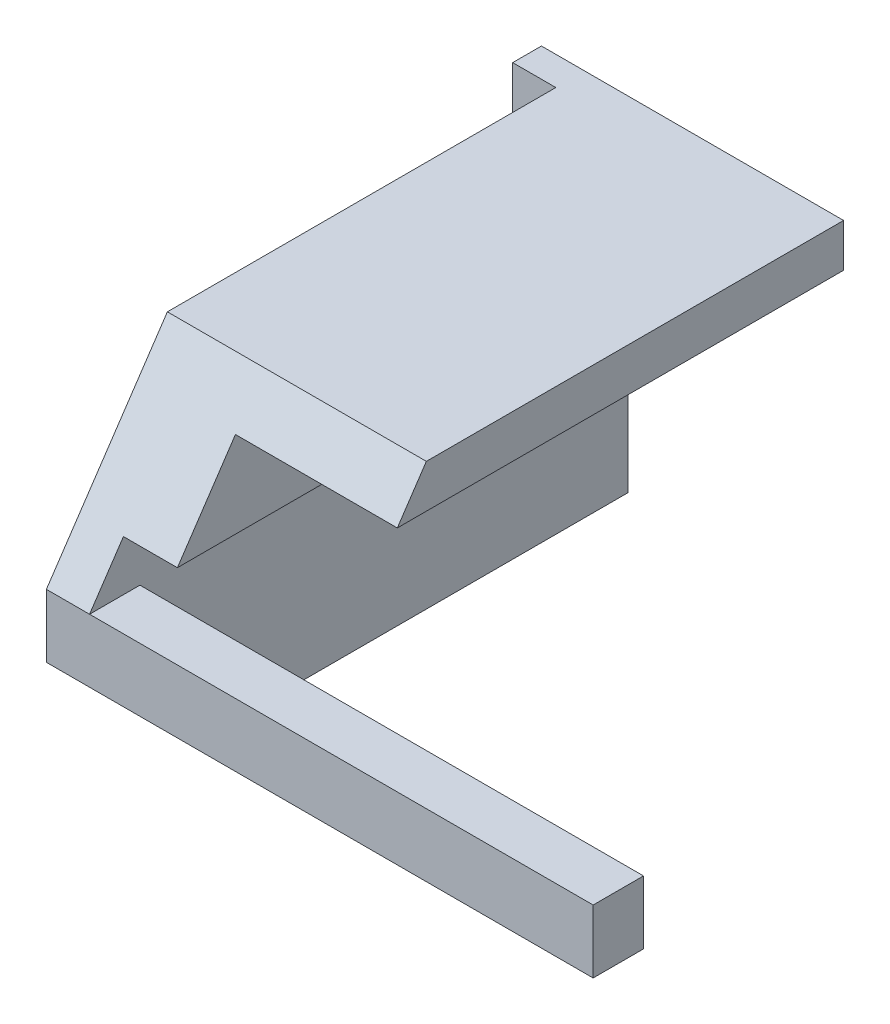
from build123d import *

# Parameters (mm, degrees)
EXTRUDE_1_DEPTH        = 5
EXTRUDE_1_DEPTH_BACK   = 3
SKETCH_2_W             = 29
SKETCH_2_H             = 29
SKETCH_3_W             = 25
SKETCH_3_H             = 25
CUT_EXTRUDE_1_DEPTH    = 3
SKETCH_5_R             = 1
CUT_EXTRUDE_3_DEPTH    = 3
CUT_EXTRUDE_4_DEPTH    = 23.011360703
HOLE_WIZARD_M4_1_D     = 3.3
HOLE_WIZARD_M4_1_DEPTH = 10.1
HOLE_WIZARD_M4_1_TIP   = 0.991420021
SKETCH_4_W             = 8
SKETCH_4_H             = 29
EXTRUDE_2_DEPTH        = 13.4052
SKETCH_7_W             = 29
SKETCH_7_H             = 5
EXTRUDE_3_DEPTH        = 5
SKETCH_10_W            = 29
SKETCH_10_H            = 13.4052
CUT_EXTRUDE_5_DEPTH    = 35.028667136
EXTRUDE_4_DEPTH        = 28
SKETCH_13_W            = 22.441758485
SKETCH_13_H            = 29
CUT_EXTRUDE_7_DEPTH    = 20.8948
SKETCH_14_W            = 27
SKETCH_14_H            = 6.1052
CUT_EXTRUDE_8_DEPTH    = 10
EXTRUDE_5_DEPTH        = 10
SKETCH_16_W            = 12.441758485
SKETCH_16_H            = 20.8948
CUT_EXTRUDE_9_DEPTH    = 5
CUT_EXTRUDE_10_DEPTH   = 5
SKETCH_18_W            = 7.441758485
SKETCH_18_H            = 20.8948
CUT_EXTRUDE_11_DEPTH   = 1.9068532
SKETCH_19_W            = 18
SKETCH_19_H            = 8
CUT_EXTRUDE_12_DEPTH   = 7
SKETCH_20_W            = 3.0931468
SKETCH_20_H            = 11
EXTRUDE_6_DEPTH        = 20
SKETCH_21_W            = 3.0931468
SKETCH_21_H            = 2.8948
CUT_EXTRUDE_13_DEPTH   = 7.441758485
SKETCH_22_W            = 29
SKETCH_22_H            = 7
CUT_EXTRUDE_14_DEPTH   = 7.558241515
EXTRUDE_7_DEPTH        = 3
SKETCH_24_W            = 3
SKETCH_24_H            = 11
CUT_EXTRUDE_15_DEPTH   = 50.942466899
CUT_EXTRUDE_16_DEPTH   = 3.8082415
SKETCH_26_W            = 11.249999985
SKETCH_26_H            = 6.1052
CUT_EXTRUDE_17_DEPTH   = 6.0931468
SKETCH_27_W            = 6.0931468
SKETCH_27_H            = 6.1052
CUT_EXTRUDE_18_DEPTH   = 43.86096708
CUT_EXTRUDE_19_DEPTH   = 3.1052
SKETCH_30_W            = 3.750000015
SKETCH_30_H            = 32.721043552
CUT_EXTRUDE_20_DEPTH   = 7.8948
CUT_EXTRUDE_21_DEPTH   = 4.9068532
SKETCH_32_W            = 31.249999985
SKETCH_32_H            = 6.0931468
CUT_EXTRUDE_22_DEPTH   = 3.5
SKETCH_33_W            = 11
SKETCH_33_H            = 13.8948
EXTRUDE_8_DEPTH        = 3
SKETCH_34_W            = 11
SKETCH_34_H            = 6.3948
CUT_EXTRUDE_25_DEPTH   = 49.005208051
EXTRUDE_9_DEPTH        = 0.3948
SKETCH_36_W            = 38
SKETCH_36_H            = 7.8948
CUT_EXTRUDE_26_DEPTH   = 2.5931468
CUT_EXTRUDE_27_DEPTH   = 3.5
SKETCH_38_W            = 1.185809648
SKETCH_38_H            = 4.3948
CUT_EXTRUDE_28_DEPTH   = 3.750000015
EXTRUDE_11_DEPTH       = 3
EXTRUDE_12_REACH       = 51.952


with BuildPart() as part:
    # 草图2 → 凸台-拉伸1 (new, two sides: drawn at the far end of the back side and taken through both)
    with BuildSketch(Plane(origin=(0, 0, 0), x_dir=(0, 0, -1), z_dir=(1, 0, 0)).offset(-EXTRUDE_1_DEPTH_BACK)):
        Rectangle(SKETCH_2_W, SKETCH_2_H)
    extrude(amount=EXTRUDE_1_DEPTH + EXTRUDE_1_DEPTH_BACK)

    # 草图3 → 切除-拉伸1 (cut)
    with BuildSketch(Plane.ZY.offset(3)):
        Rectangle(SKETCH_3_W, SKETCH_3_H)
    extrude(amount=-CUT_EXTRUDE_1_DEPTH, mode=Mode.SUBTRACT)

    # 草图5 → 切除-拉伸3 (cut)
    with BuildSketch(Plane.ZY.offset(3)):
        with Locations((-12.5, -12.5)):
            Circle(SKETCH_5_R)
    extrude(amount=-CUT_EXTRUDE_3_DEPTH, mode=Mode.SUBTRACT)

    # 草图6 → 切除-拉伸4 (cut, through all)
    with BuildSketch(Plane.ZY.offset(3)):
        Polygon((12.5, 12.5), (12.5, -12.5), (14.5, -12.5), (14.5, 14.5), (-12.5, 14.5), (-14.5, 14.5), (-14.5, 12.5), (-12.5, 12.5), align=None)
    extrude(amount=-CUT_EXTRUDE_4_DEPTH, mode=Mode.SUBTRACT)

    # M4 螺纹孔1
    with Locations(Plane.ZY):
        with Locations((0, 0)):
            Hole(HOLE_WIZARD_M4_1_D / 2, depth=HOLE_WIZARD_M4_1_DEPTH)
            with Locations((0, 0, -(HOLE_WIZARD_M4_1_DEPTH + HOLE_WIZARD_M4_1_TIP / 2))):  # 118° drill point
                Cone(0, HOLE_WIZARD_M4_1_D / 2, HOLE_WIZARD_M4_1_TIP, mode=Mode.SUBTRACT)

    # 草图4 → 凸台-拉伸2 (add)
    with BuildSketch(Plane.XZ.offset(14.5)):
        with Locations((1, 0)):
            Rectangle(SKETCH_4_W, SKETCH_4_H)
    extrude(amount=EXTRUDE_2_DEPTH)

    # 草图7 → 凸台-拉伸3 (add)
    with BuildSketch(Plane(origin=(5, 0, 0), x_dir=(0, 0, -1), z_dir=(1, 0, 0))):
        with Locations((0, -25.4052)):
            Rectangle(SKETCH_7_W, SKETCH_7_H)
    extrude(amount=EXTRUDE_3_DEPTH)

    # 草图10 → 切除-拉伸5 (cut, through all)
    with BuildSketch(Plane.ZY.offset(3)):
        with Locations((0, -21.2026)):
            Rectangle(SKETCH_10_W, SKETCH_10_H)
    extrude(amount=-CUT_EXTRUDE_5_DEPTH, mode=Mode.SUBTRACT)

    # 草图12 → 凸台-拉伸4 (add)
    with BuildSketch(Plane(origin=(5, 0, 0), x_dir=(0, 0, -1), z_dir=(1, 0, 0))):
        Polygon((-14.5, -14.5), (14.5, -14.5), (14.5, 12.5), (-12.5, 12.5), (-12.5, -12.5), (-14.5, -12.5), align=None)
    extrude(amount=EXTRUDE_4_DEPTH)

    # 草图13 → 切除-拉伸7 (cut)
    with BuildSketch(Plane.XZ.offset(14.5)):
        with Locations((21.779120757, 0)):
            Rectangle(SKETCH_13_W, SKETCH_13_H)
    extrude(amount=-CUT_EXTRUDE_7_DEPTH, mode=Mode.SUBTRACT)

    # 草图14 → 切除-拉伸8 (cut)
    with BuildSketch(Plane(origin=(33, 0, 0), x_dir=(0, 0, -1), z_dir=(1, 0, 0))):
        with Locations((1, 9.4474)):
            Rectangle(SKETCH_14_W, SKETCH_14_H)
    extrude(amount=-CUT_EXTRUDE_8_DEPTH, mode=Mode.SUBTRACT)

    # 草图15 → 凸台-拉伸5 (add)
    with BuildSketch(Plane.XY.offset(12.5)):
        Polygon((23, 6.3948), (23, 12.5), (0, 12.5), (0, -14.5), (23, -14.5), align=None)
    extrude(amount=EXTRUDE_5_DEPTH)

    # 草图16 → 切除-拉伸9 (cut)
    with BuildSketch(Plane(origin=(0, 0, 12.5), x_dir=(-1, 0, 0), z_dir=(0, 0, -1))):
        with Locations((-16.779120757, -4.0526)):
            Rectangle(SKETCH_16_W, SKETCH_16_H)
    extrude(amount=-CUT_EXTRUDE_9_DEPTH, mode=Mode.SUBTRACT)

    # 草图17 → 切除-拉伸10 (cut)
    with BuildSketch(Plane(origin=(23, 0, 0), x_dir=(0, 0, -1), z_dir=(1, 0, 0))):
        Polygon((-17.5, -14.5), (-17.5, 6.3948), (14.5, 6.3948), (14.5, 12.5), (-22.5, 12.5), (-22.5, -14.5), align=None)
    extrude(amount=-CUT_EXTRUDE_10_DEPTH, mode=Mode.SUBTRACT)

    # 草图18 → 切除-拉伸11 (cut)
    with BuildSketch(Plane(origin=(0, 0, 17.5), x_dir=(-1, 0, 0), z_dir=(0, 0, -1))):
        with Locations((-14.279120757, -4.0526)):
            Rectangle(SKETCH_18_W, SKETCH_18_H)
    extrude(amount=-CUT_EXTRUDE_11_DEPTH, mode=Mode.SUBTRACT)

    # 草图19 → 切除-拉伸12 (cut)
    with BuildSketch(Plane.XZ.offset(14.5)):
        with Locations((9, 18.5)):
            Rectangle(SKETCH_19_W, SKETCH_19_H)
    extrude(amount=-CUT_EXTRUDE_12_DEPTH, mode=Mode.SUBTRACT)

    # 草图20 → 凸台-拉伸6 (add)
    with BuildSketch(Plane(origin=(18, 0, 0), x_dir=(0, 0, -1), z_dir=(1, 0, 0))):
        with Locations((-20.9534266, -2)):
            Rectangle(SKETCH_20_W, SKETCH_20_H)
    extrude(amount=EXTRUDE_6_DEPTH)

    # 草图21 → 切除-拉伸13 (cut)
    with BuildSketch(Plane(origin=(18, 0, 0), x_dir=(0, 0, -1), z_dir=(1, 0, 0))):
        with Locations((-20.9534266, 4.9474)):
            Rectangle(SKETCH_21_W, SKETCH_21_H)
    extrude(amount=-CUT_EXTRUDE_13_DEPTH, mode=Mode.SUBTRACT)

    # 草图22 → 切除-拉伸14 (cut)
    with BuildSketch(Plane(origin=(10.558241515, 0, 0), x_dir=(0, 0, -1), z_dir=(1, 0, 0))):
        with Locations((0, -11)):
            Rectangle(SKETCH_22_W, SKETCH_22_H)
    extrude(amount=-CUT_EXTRUDE_14_DEPTH, mode=Mode.SUBTRACT)

    # 草图23 → 凸台-拉伸7 (add)
    with BuildSketch(Plane.XY.offset(22.5)):
        Polygon((10.558241515, 6.3948), (18, 6.3948), (18, 12.5), (0, 12.5), (0, -7.5), (38, -7.5), (38, 3.5), (10.558241515, 3.5), align=None)
    extrude(amount=EXTRUDE_7_DEPTH)

    # 草图24 → 切除-拉伸15 (cut, through all)
    with BuildSketch(Plane.XZ.offset(7.5)):
        with Locations((1.5, 20)):
            Rectangle(SKETCH_24_W, SKETCH_24_H)
    extrude(amount=-CUT_EXTRUDE_15_DEPTH, mode=Mode.SUBTRACT)

    # 草图25 → 切除-拉伸16 (cut)
    with BuildSketch(Plane(origin=(10.558241515, 0, 0), x_dir=(0, 0, -1), z_dir=(1, 0, 0))):
        Polygon((-19.4068532, -7.5), (14.5, -7.5), (14.5, 6.3948), (-25.5, 6.3948), (-25.5, 3.5), (-19.4068532, 3.5), align=None)
    extrude(amount=-CUT_EXTRUDE_16_DEPTH, mode=Mode.SUBTRACT)

    # 草图26 → 切除-拉伸17 (cut)
    with BuildSketch(Plane.XY.offset(25.5)):
        with Locations((12.375000008, 9.4474)):
            Rectangle(SKETCH_26_W, SKETCH_26_H)
    extrude(amount=-CUT_EXTRUDE_17_DEPTH, mode=Mode.SUBTRACT)

    # 草图27 → 切除-拉伸18 (cut, through all)
    with BuildSketch(Plane(origin=(6.750000015, 0, 0), x_dir=(0, 0, -1), z_dir=(1, 0, 0))):
        with Locations((-22.4534266, 9.4474)):
            Rectangle(SKETCH_27_W, SKETCH_27_H)
    extrude(amount=-CUT_EXTRUDE_18_DEPTH, mode=Mode.SUBTRACT)

    # 草图28 → 切除-拉伸19 (cut)
    with BuildSketch(Plane(origin=(0, 12.5, 0), x_dir=(1, 0, 0), z_dir=(0, 1, 0))):
        Polygon((3, -14.5), (3, -19.4068532), (18, -19.4068532), (18, 14.5), (-3, 14.5), (-3, 12.5), (0, 12.5), (0, -14.5), align=None)
    extrude(amount=-CUT_EXTRUDE_19_DEPTH, mode=Mode.SUBTRACT)

    # 草图30 → 切除-拉伸20 (cut)
    with BuildSketch(Plane.XZ.offset(7.5)):
        with Locations((4.875000008, 1.860521776)):
            Rectangle(SKETCH_30_W, SKETCH_30_H)
    extrude(amount=-CUT_EXTRUDE_20_DEPTH, mode=Mode.SUBTRACT)

    # 草图31 → 切除-拉伸21 (cut)
    with BuildSketch(Plane.XY.offset(19.4068532)):
        Polygon((18, 6.3948), (18, 9.3948), (3, 9.3948), (3, 6.3948), (6.750000015, 6.3948), align=None)
    extrude(amount=-CUT_EXTRUDE_21_DEPTH, mode=Mode.SUBTRACT)

    # 草图32 → 切除-拉伸22 (cut)
    with BuildSketch(Plane(origin=(0, 3.5, 0), x_dir=(1, 0, 0), z_dir=(0, 1, 0))):
        with Locations((22.375000007, -22.4534266)):
            Rectangle(SKETCH_32_W, SKETCH_32_H)
    extrude(amount=-CUT_EXTRUDE_22_DEPTH, mode=Mode.SUBTRACT)

    # 草图33 → 凸台-拉伸8 (add)
    with BuildSketch(Plane.ZY.offset(-3)):
        with Locations((20, -0.5526)):
            Rectangle(SKETCH_33_W, SKETCH_33_H)
    extrude(amount=EXTRUDE_8_DEPTH)

    # 草图34 → 切除-拉伸25 (cut, through all)
    with BuildSketch(Plane(origin=(0, 0, 0), x_dir=(0, 0, -1), z_dir=(1, 0, 0))):
        with Locations((-20, 3.1974)):
            Rectangle(SKETCH_34_W, SKETCH_34_H)
    extrude(amount=CUT_EXTRUDE_25_DEPTH, mode=Mode.SUBTRACT)

    # 草图35 → 凸台-拉伸9 (add)
    with BuildSketch(Plane(origin=(0, 0, 0), x_dir=(1, 0, 0), z_dir=(0, 1, 0))):
        Polygon((38, -25.5), (38, -19.4068532), (6.750000015, -19.4068532), (6.750000015, -18.221043552), (3, -18.221043552), (3, -14.5), (0, -14.5), (0, -25.5), align=None)
    extrude(amount=EXTRUDE_9_DEPTH)

    # 草图36 → 切除-拉伸26 (cut)
    with BuildSketch(Plane.XY.offset(25.5)):
        with Locations((19, -3.5526)):
            Rectangle(SKETCH_36_W, SKETCH_36_H)
    extrude(amount=-CUT_EXTRUDE_26_DEPTH, mode=Mode.SUBTRACT)

    # 草图37 → 切除-拉伸27 (cut)
    with BuildSketch(Plane(origin=(0, 0.3948, 0), x_dir=(1, 0, 0), z_dir=(0, 1, 0))):
        Polygon((3, -14.5), (0, -14.5), (0, -22.9068532), (38, -22.9068532), (38, -19.4068532), (6.750000015, -19.4068532), (6.750000015, -18.221043552), (3, -18.221043552), align=None)
    extrude(amount=-CUT_EXTRUDE_27_DEPTH, mode=Mode.SUBTRACT)

    # 草图38 → 切除-拉伸28 (cut)
    with BuildSketch(Plane(origin=(6.750000015, 0, 0), x_dir=(0, 0, -1), z_dir=(1, 0, 0))):
        with Locations((-18.813948376, -5.3026)):
            Rectangle(SKETCH_38_W, SKETCH_38_H)
    extrude(amount=-CUT_EXTRUDE_28_DEPTH, mode=Mode.SUBTRACT)

    # 草图39 → 凸台-拉伸11 (add)
    with BuildSketch(Plane(origin=(3, 0, 0), x_dir=(0, 0, -1), z_dir=(1, 0, 0))):
        Polygon((-14.5, 9.3948), (-14.5, -14.5), (-22.9068532, -7.5), (-22.9068532, -3.1052), align=None)
    extrude(amount=-EXTRUDE_11_DEPTH)

    # 凸台-拉伸12: up to this face of the body (flat: up to its plane)
    extrude_12_end = Plane(part.part.faces().sort_by_distance((1.5, 3.1448, 18.7034266))[0])
    # 草图40 → 凸台-拉伸12 (add, up to the picked face)
    with BuildSketch(Plane.XY.offset(14.5), mode=Mode.PRIVATE) as extrude_12_sk1:
        Polygon((3, 9.3948), (3, 0.3948), (6.750000015, 0.3948), (6.750000015, 6.3948), (18, 6.3948), (18, 9.3948), align=None)
    extrude_12_tool1 = split(extrude(extrude_12_sk1.sketch, amount=EXTRUDE_12_REACH, mode=Mode.PRIVATE), bisect_by=extrude_12_end, keep=Keep.BOTH, mode=Mode.PRIVATE)
    add(extrude_12_tool1.solids().sort_by(Axis((3.174929, 4.8948, 14.5), (0, 0, 1)))[0])


solid = part.part
